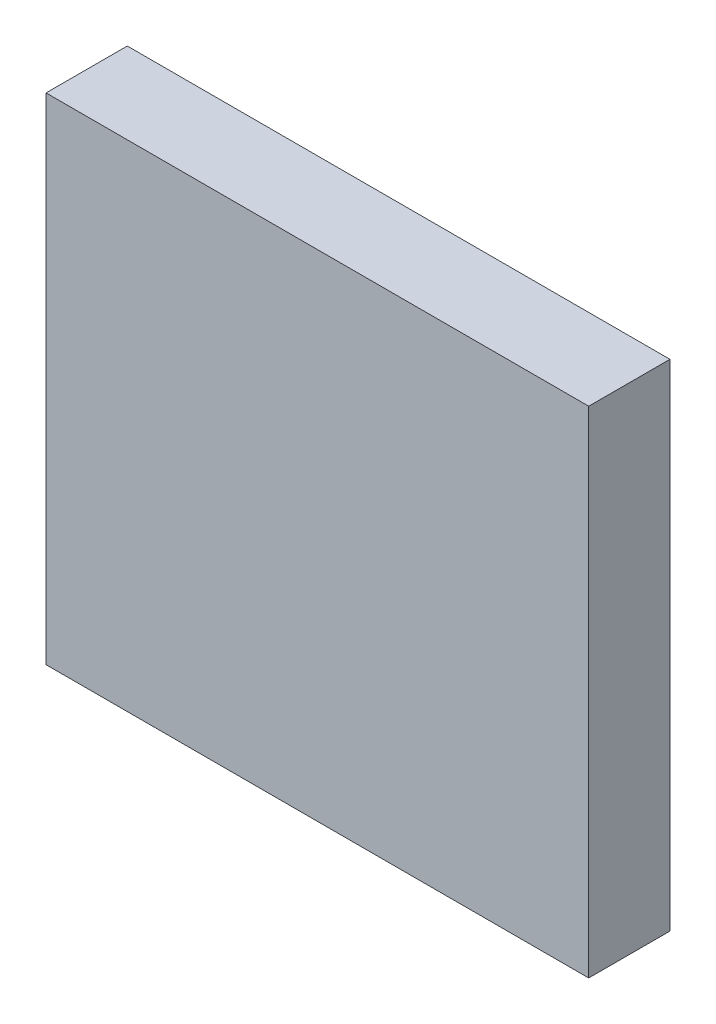
from build123d import *

# Parameters (mm, degrees)
SKIZZE1_W               = 6.6802
SKIZZE1_H               = 6.096
COMPONENT_OUTLINE_DEPTH = 1


with BuildPart() as part:
    # Skizze1 → Component_Outline (new body)
    with BuildSketch(Plane.XY):
        with Locations((0.0381, 0)):
            Rectangle(SKIZZE1_W, SKIZZE1_H)
    extrude(amount=COMPONENT_OUTLINE_DEPTH)


solid = part.part
